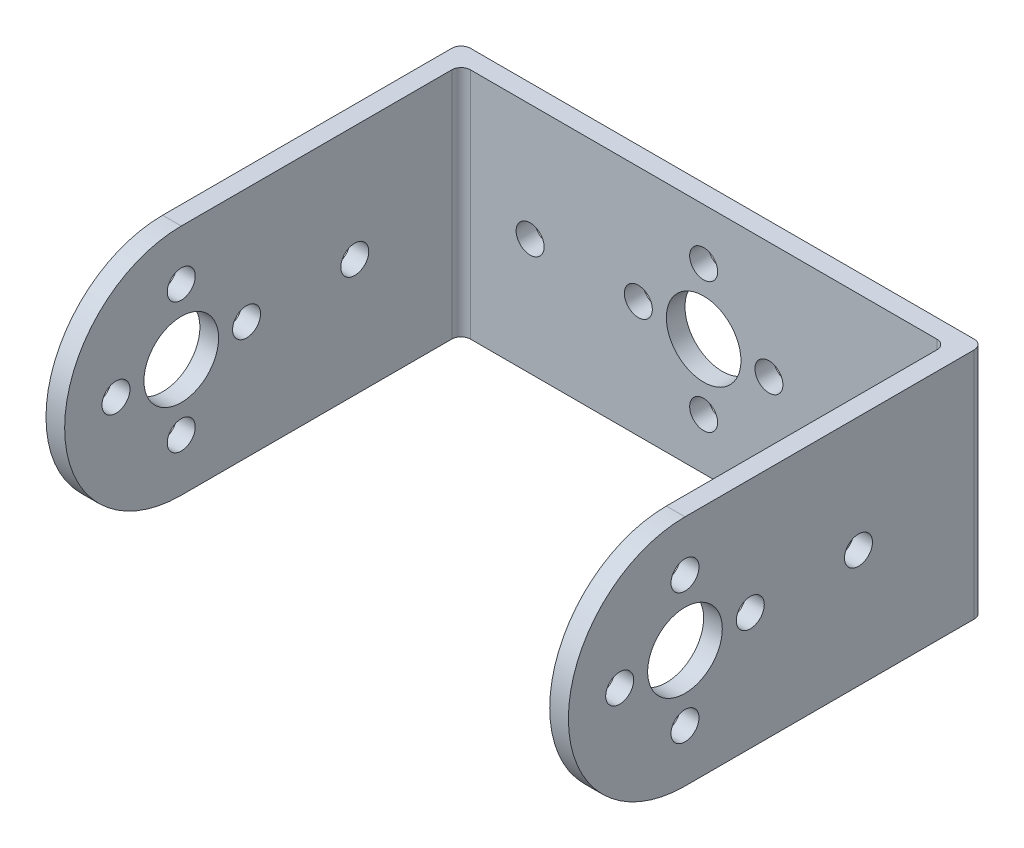
from build123d import *

# Parameters (mm, degrees)
SKETCH_1_W          = 56
SKETCH_1_H          = 25
EXTRUDE_1_DEPTH     = 44.5
CUT_EXTRUDE_1_DEPTH = 59.21726548
CUT_EXTRUDE_2_DEPTH = 73.611982482
SKETCH_4_R          = 4
SKETCH_4_R_2        = 1.5
CUT_EXTRUDE_3_DEPTH = 53.407060593
SKETCH_5_R          = 4
SKETCH_5_R_2        = 1.5
CUT_EXTRUDE_4_DEPTH = 73.611982482
FILLET_1_R          = 1


with BuildPart() as part:
    # 草图1 → 凸台-拉伸1 (new body)
    with BuildSketch(Plane.XY):
        Rectangle(SKETCH_1_W, SKETCH_1_H)
    extrude(amount=EXTRUDE_1_DEPTH)

    # 草图2 → 切除-拉伸1 (cut, through all)
    with BuildSketch(Plane.XZ.offset(12.5)):
        Polygon((0, 44.5), (26, 44.5), (26, 2), (-26, 2), (-26, 44.5), align=None)
    extrude(amount=-CUT_EXTRUDE_1_DEPTH, mode=Mode.SUBTRACT)

    # 草图3 → 切除-拉伸2 (cut, through all)
    with BuildSketch(Plane(origin=(28, 0, 0), x_dir=(0, 0, -1), z_dir=(1, 0, 0))):
        with BuildLine():
            ThreePointArc((-44.5, 0), (-40.838834765, 8.838834765), (-32, 12.5))
            Line((-32, 12.5), (-44.5, 12.5))
            Line((-44.5, 12.5), (-44.5, 0))
        make_face()
        with BuildLine():
            ThreePointArc((-32, -12.5), (-40.838834765, -8.838834765), (-44.5, 0))
            Line((-44.5, 0), (-44.5, -12.5))
            Line((-44.5, -12.5), (-32, -12.5))
        make_face()
    extrude(amount=-CUT_EXTRUDE_2_DEPTH, mode=Mode.SUBTRACT)

    # 草图4 → 切除-拉伸3 (cut, through all)
    with BuildSketch(Plane.XY.offset(2)):
        Circle(SKETCH_4_R)
        with Locations((0, 7)):
            Circle(SKETCH_4_R_2)
        with Locations((0, -7)):
            Circle(SKETCH_4_R_2)
        with Locations((-7, 0)):
            Circle(SKETCH_4_R_2)
        with Locations((7, 0)):
            Circle(SKETCH_4_R_2)
        with Locations((18.6, 0)):
            Circle(SKETCH_4_R_2)
        with Locations(Location((-18.6, 0, 0), (0, 0, 180))):
            Circle(SKETCH_4_R_2)
    extrude(amount=-CUT_EXTRUDE_3_DEPTH, mode=Mode.SUBTRACT)

    # 草图5 → 切除-拉伸4 (cut, through all)
    with BuildSketch(Plane(origin=(28, 0, 0), x_dir=(0, 0, -1), z_dir=(1, 0, 0))):
        with Locations((-32, 0.108344676)):
            Circle(SKETCH_5_R)
        with Locations((-32, 7.108344676)):
            Circle(SKETCH_5_R_2)
        with Locations((-39, 0.108344676)):
            Circle(SKETCH_5_R_2)
        with Locations((-32, -6.891655324)):
            Circle(SKETCH_5_R_2)
        with Locations((-25, 0.108344676)):
            Circle(SKETCH_5_R_2)
        with Locations((-13.4, 0.108344676)):
            Circle(SKETCH_5_R_2)
    extrude(amount=-CUT_EXTRUDE_4_DEPTH, mode=Mode.SUBTRACT)

    # 圆角1
    fillet_1_edges = [part.edges().sort_by_distance(p)[0] for p in [
        (26, 0, 2),
        (-26, 0, 2),
        (-28, 0, 0),
        (28, 0, 0),
    ]]
    fillet(fillet_1_edges, radius=FILLET_1_R)


solid = part.part
